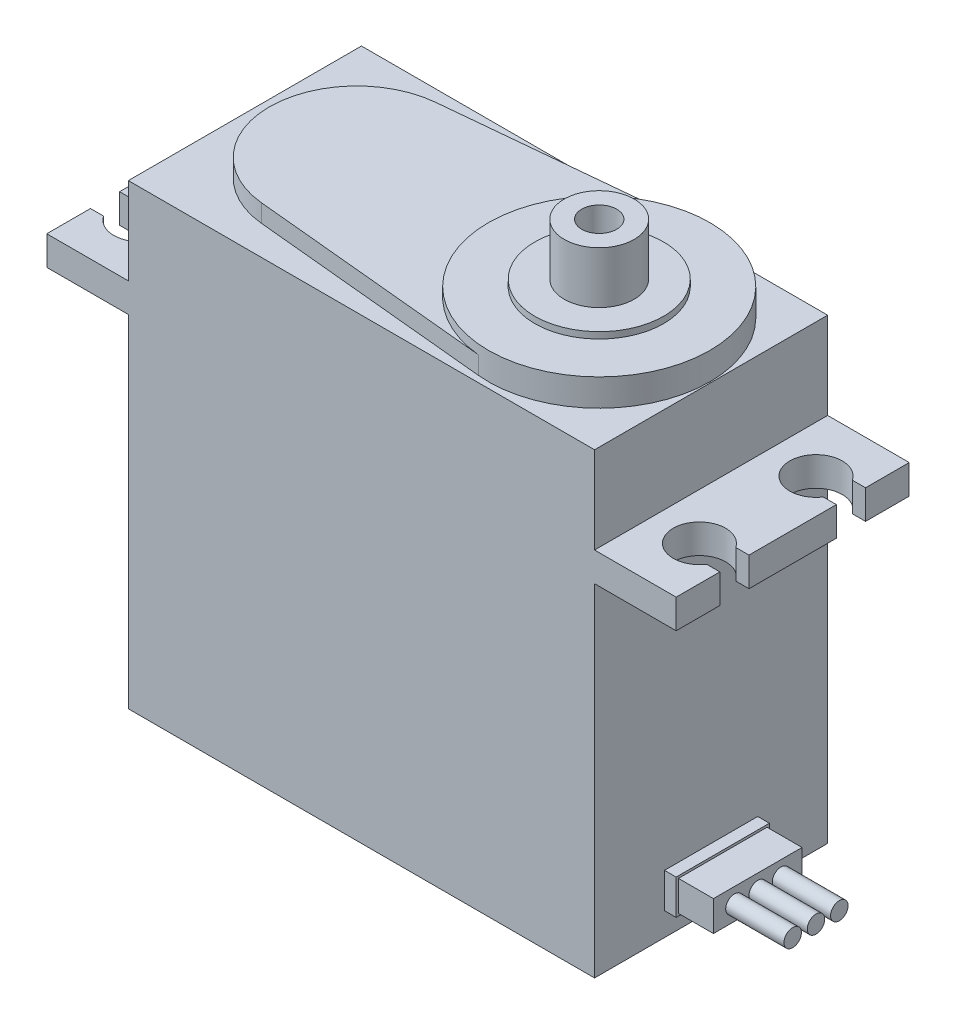
from build123d import *

# Parameters (mm, degrees)
SKETCH_1_W          = 40
SKETCH_1_H          = 20
EXTRUDE_1_DEPTH     = 29.3
EXTRUDE_2_DEPTH     = 2.5
SKETCH_3_W          = 40
SKETCH_3_H          = 20
EXTRUDE_3_DEPTH     = 7.45
EXTRUDE_4_DEPTH     = 1.53
SKETCH_5_R          = 9.5
EXTRUDE_5_DEPTH     = 0.8
SKETCH_6_R          = 3
EXTRUDE_6_DEPTH     = 5
SKETCH_7_W          = 8
SKETCH_7_H          = 3
EXTRUDE_7_DEPTH     = 1
SKETCH_8_W          = 7.6
SKETCH_8_H          = 2.6
EXTRUDE_8_DEPTH     = 3
SKETCH_9_R          = 0.75
EXTRUDE_9_DEPTH     = 5
SKETCH_10_R         = 1.5
CUT_EXTRUDE_1_DEPTH = 3
SKETCH_11_R         = 5.525
EXTRUDE_11_DEPTH    = 0.55


with BuildPart() as part:
    # 스케치1 → 보스-돌출1 (new body)
    with BuildSketch(Plane(origin=(0, 0, 0), x_dir=(1, 0, 0), z_dir=(0, 1, 0))):
        Rectangle(SKETCH_1_W, SKETCH_1_H)
    extrude(amount=EXTRUDE_1_DEPTH)

    # 스케치2 → 보스-돌출2 (add)
    with BuildSketch(Plane(origin=(0, 29.3, 0), x_dir=(1, 0, 0), z_dir=(0, 1, 0))):
        with BuildLine():
            Line((-27, 10), (27, 10))
            Line((27, 10), (27, 6.25))
            Line((27, 6.25), (25.868643032, 6.25))
            ThreePointArc((25.868643032, 6.25), (21.751817004, 5), (25.868643032, 3.75))
            Line((25.868643032, 3.75), (27, 3.75))
            Line((27, 3.75), (27, -3.75))
            Line((27, -3.75), (25.866173833, -3.75))
            ThreePointArc((25.866173833, -3.75), (21.753868932, -5), (25.866173833, -6.25))
            Line((25.866173833, -6.25), (27, -6.25))
            Line((27, -6.25), (27, -10))
            Line((27, -10), (-27, -10))
            Line((-27, -10), (-27, -6.25))
            Line((-27, -6.25), (-25.870828693, -6.25))
            ThreePointArc((-25.870828693, -6.25), (-21.75, -5), (-25.870828693, -3.75))
            Line((-25.870828693, -3.75), (-27, -3.75))
            Line((-27, -3.75), (-27, 3.75))
            Line((-27, 3.75), (-25.870828693, 3.75))
            ThreePointArc((-25.870828693, 3.75), (-21.75, 5), (-25.870828693, 6.25))
            Line((-25.870828693, 6.25), (-27, 6.25))
            Line((-27, 6.25), (-27, 10))
        make_face()
    extrude(amount=EXTRUDE_2_DEPTH)

    # 스케치3 → 보스-돌출3 (add)
    with BuildSketch(Plane(origin=(0, 31.8, 0), x_dir=(1, 0, 0), z_dir=(0, 1, 0))):
        Rectangle(SKETCH_3_W, SKETCH_3_H)
    extrude(amount=EXTRUDE_3_DEPTH)

    # 스케치4 → 보스-돌출4 (add)
    with BuildSketch(Plane(origin=(0, 39.25, 0), x_dir=(1, 0, 0), z_dir=(0, 1, 0))):
        with BuildLine():
            Line((-11.105930899, 7.466746492), (9.486550883, 9.4559828))
            ThreePointArc((9.486550883, 9.4559828), (19.9, -1.9624e-05), (9.486511816, -9.455979026))
            Line((9.486511816, -9.455979026), (-11.105960469, -7.466657767))
            ThreePointArc((-11.105960469, -7.466657767), (-17.9, 5.7816e-05), (-11.105930899, 7.466746492))
        make_face()
    extrude(amount=EXTRUDE_4_DEPTH)

    # 스케치5 → 보스-돌출5 (add)
    with BuildSketch(Plane(origin=(0, 40.78, 0), x_dir=(1, 0, 0), z_dir=(0, 1, 0))):
        with Locations(Location((10.4, 0, 0), (0, 0, 95.517659112))):
            Circle(SKETCH_5_R)
    extrude(amount=EXTRUDE_5_DEPTH)

    # 스케치6 → 보스-돌출6 (add)
    with BuildSketch(Plane(origin=(0, 41.58, 0), x_dir=(1, 0, 0), z_dir=(0, 1, 0))):
        with Locations(Location((10.4, 0, 0), (0, 0, 270))):
            Circle(SKETCH_6_R)
    extrude(amount=EXTRUDE_6_DEPTH)

    # 스케치7 → 보스-돌출7 (add)
    with BuildSketch(Plane(origin=(20, 0, 0), x_dir=(0, 0, -1), z_dir=(1, 0, 0))):
        with Locations((0, 3.5)):
            Rectangle(SKETCH_7_W, SKETCH_7_H)
    extrude(amount=EXTRUDE_7_DEPTH)

    # 스케치8 → 보스-돌출8 (add)
    with BuildSketch(Plane(origin=(21, 0, 0), x_dir=(0, 0, -1), z_dir=(1, 0, 0))):
        with Locations((0, 3.5)):
            Rectangle(SKETCH_8_W, SKETCH_8_H)
    extrude(amount=EXTRUDE_8_DEPTH)

    # 스케치9 → 보스-돌출9 (add)
    with BuildSketch(Plane(origin=(24, 0, 0), x_dir=(0, 0, -1), z_dir=(1, 0, 0))):
        with Locations((0, 3.505070748)):
            Circle(SKETCH_9_R)
        with Locations((-1.999991967, 3.499402084)):
            Circle(SKETCH_9_R)
        with Locations((1.99999474, 3.500483844)):
            Circle(SKETCH_9_R)
    extrude(amount=EXTRUDE_9_DEPTH)

    # 스케치10 → 컷-돌출1 (cut)
    with BuildSketch(Plane(origin=(0, 46.58, 0), x_dir=(1, 0, 0), z_dir=(0, 1, 0))):
        with Locations(Location((10.4, 0, 0), (0, 0, 270))):
            Circle(SKETCH_10_R)
    extrude(amount=-CUT_EXTRUDE_1_DEPTH, mode=Mode.SUBTRACT)

    # 스케치11 → 보스-돌출11 (add)
    with BuildSketch(Plane(origin=(0, 41.58, 0), x_dir=(1, 0, 0), z_dir=(0, 1, 0))):
        with Locations(Location((10.4, 0, 0), (0, 0, 270))):
            Circle(SKETCH_11_R)
    extrude(amount=EXTRUDE_11_DEPTH)


solid = part.part
